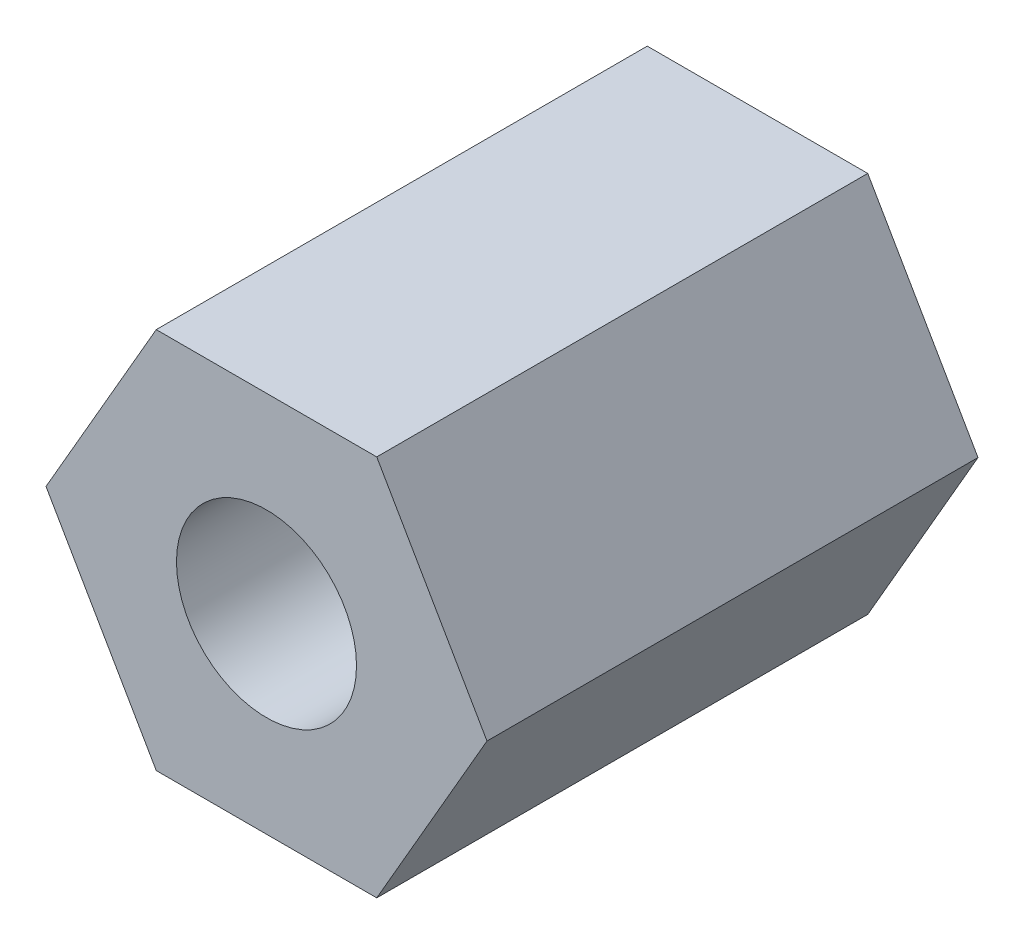
from build123d import *

# Parameters (mm, degrees)
EXTRUDE_1_DEPTH = 9
M4X0_7_1_D      = 3.3


with BuildPart() as part:
    # 草圖1 → 填料-伸長1 (new body)
    with BuildSketch(Plane.XY):
        Polygon((-2.020725942, 3.5), (-4.041451884, 0), (-2.020725942, -3.5), (2.020725942, -3.5), (4.041451884, 0), (2.020725942, 3.5), align=None)
    extrude(amount=EXTRUDE_1_DEPTH)

    # M4x0.7 螺紋孔1 (through all)
    with Locations(Plane.XY.offset(9)):
        with Locations((0, 0)):
            Hole(M4X0_7_1_D / 2)


solid = part.part
